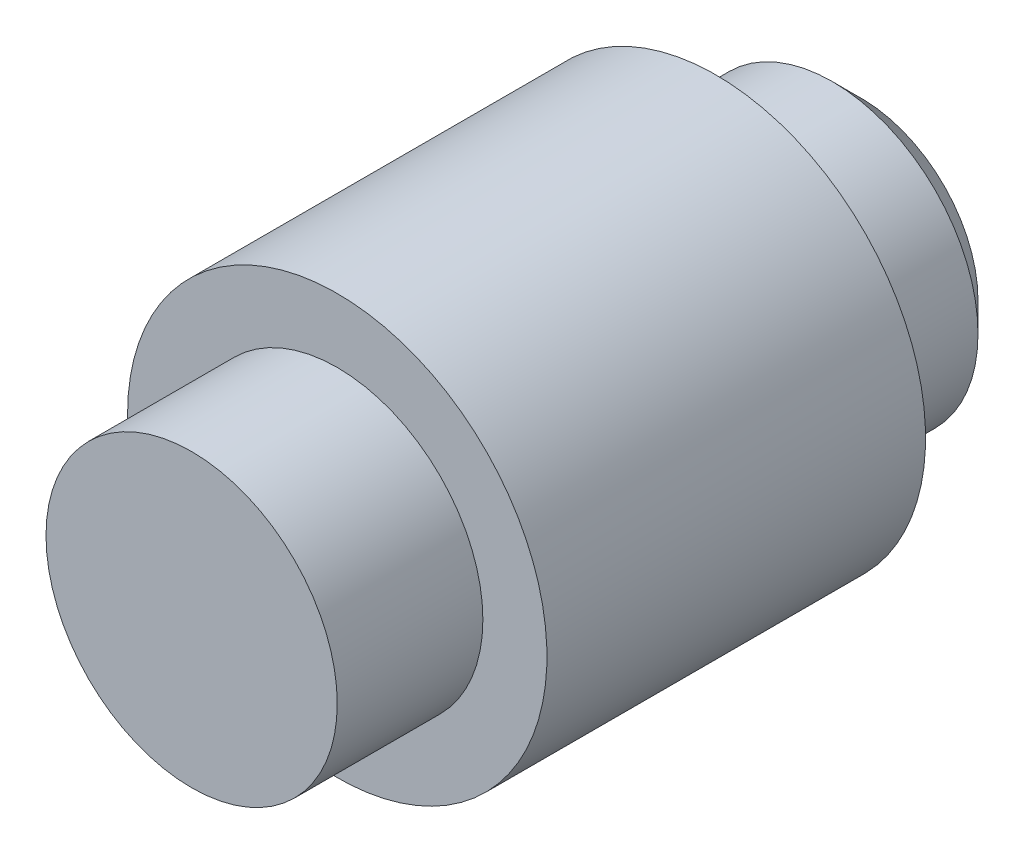
from build123d import *

# Parameters (mm, degrees)
SKETCH3_R           = 3.6
BOSS_EXTRUDE1_DEPTH = 6.5
SKETCH4_R           = 2.5
BOSS_EXTRUDE2_DEPTH = 2.5
BOSS_EXTRUDE3_START = 2.5
SKETCH5_R           = 2.5
BOSS_EXTRUDE3_DEPTH = 2.5
CHAMFER1_SIZE       = 0.5


with BuildPart() as part:
    # Sketch3 → Boss-Extrude1 (new body)
    with BuildSketch(Plane.XY):
        with Locations(Location((0, 0, 0), (0, 0, 180))):
            Circle(SKETCH3_R)
    extrude(amount=BOSS_EXTRUDE1_DEPTH)

    # Sketch4 → Boss-Extrude2 (add)
    with BuildSketch(Plane.XY):
        Circle(SKETCH4_R)
    extrude(amount=-BOSS_EXTRUDE2_DEPTH)

    # Sketch5 → Boss-Extrude3 (add)
    with BuildSketch(Plane.XY.offset(6.5).offset(BOSS_EXTRUDE3_START)):
        Circle(SKETCH5_R)
    extrude(amount=-BOSS_EXTRUDE3_DEPTH)

    # Chamfer1
    chamfer1_edges = [part.edges().sort_by_distance(p)[0] for p in [
        (-2.5, 0, -2.5),
    ]]
    chamfer(chamfer1_edges, length=CHAMFER1_SIZE)


solid = part.part
